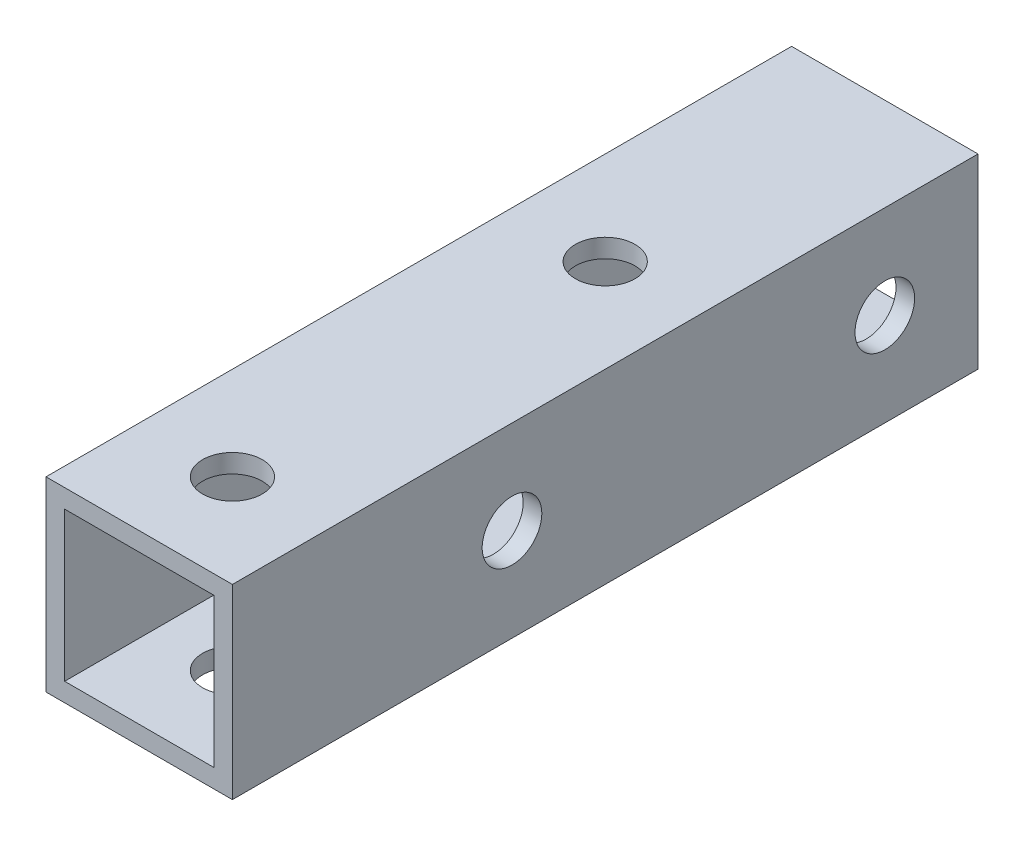
from build123d import *

# Parameters (mm, degrees)
SKETCH_283_W          = 10
SKETCH_283_H          = 10
SKETCH_283_W_2        = 8
SKETCH_283_H_2        = 8
EXTRUDE_340_DEPTH     = 40
SKETCH_412_R          = 1.6
CUT_EXTRUDE_825_DEPTH = 42.533119315
SKETCH_631_R          = 1.6
CUT_EXTRUDE_869_DEPTH = 42.533119315


with BuildPart() as part:
    # Sketch 283 → Extrude 340 (new body)
    with BuildSketch(Plane.XY):
        Rectangle(SKETCH_283_W, SKETCH_283_H)
        Rectangle(SKETCH_283_W_2, SKETCH_283_H_2, mode=Mode.SUBTRACT)
    extrude(amount=EXTRUDE_340_DEPTH)

    # Sketch 412 → Cut-Extrude 825 (cut, through all)
    with BuildSketch(Plane(origin=(0, 5, 0), x_dir=(1, 0, 0), z_dir=(0, 1, 0))):
        with Locations(Location((0, -15, 0), (0, 0, 270))):
            Circle(SKETCH_412_R)
        with Locations(Location((0, -35, 0), (0, 0, 270))):
            Circle(SKETCH_412_R)
    extrude(amount=-CUT_EXTRUDE_825_DEPTH, mode=Mode.SUBTRACT)

    # Sketch 631 → Cut-Extrude 869 (cut, through all)
    with BuildSketch(Plane(origin=(5, 0, 0), x_dir=(0, 0, -1), z_dir=(1, 0, 0))):
        with Locations((-5, 0)):
            Circle(SKETCH_631_R)
        with Locations((-25, 0)):
            Circle(SKETCH_631_R)
    extrude(amount=-CUT_EXTRUDE_869_DEPTH, mode=Mode.SUBTRACT)


solid = part.part
